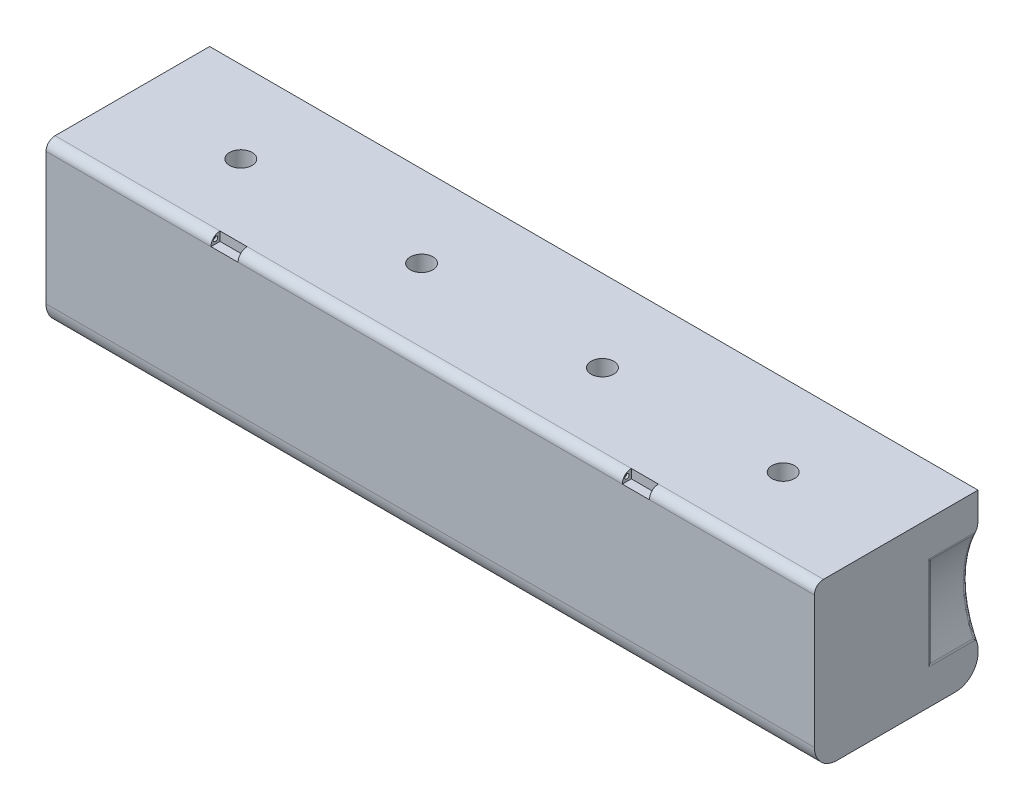
from build123d import *

# Parameters (mm, degrees)
SKETCH1_W           = 85
SKETCH1_H           = 18.1
BOSS_EXTRUDE1_DEPTH = 18.1
SKETCH2_W           = 80
SKETCH2_H           = 13.1
CUT_EXTRUDE1_DEPTH  = 17.5
SKETCH3_R           = 1.25
CUT_EXTRUDE2_DEPTH  = 2.5
SKETCH4_W           = 3
SKETCH4_H           = 1
CUT_EXTRUDE4_DEPTH  = 1
BOSS_EXTRUDE3_DEPTH = 1
SKETCH5_R           = 0.25
CUT_EXTRUDE5_DEPTH  = 0.25
CUT_EXTRUDE6_START  = -0.25
SKETCH6_R           = 0.25
CUT_EXTRUDE6_DEPTH  = 0.25
CUT_EXTRUDE7_START  = -0.25
SKETCH7_R           = 0.25
CUT_EXTRUDE7_DEPTH  = 0.25
SKETCH8_R           = 0.25
CUT_EXTRUDE8_DEPTH  = 0.25
CUT_EXTRUDE9_REACH  = 89.376
SKETCH13_R          = 1.390804474
SKETCH13_R_2        = 0.659370612
SKETCH13_R_3        = 0.42561601
CUT_EXTRUDE10_DEPTH = 0.5
CUT_EXTRUDE11_DEPTH = 5
FILLET1_R           = 0.5
CUT_EXTRUDE12_START = -85
CUT_EXTRUDE12_DEPTH = 85


with BuildPart() as part:
    # Sketch1 → Boss-Extrude1 (new body)
    with BuildSketch(Plane.XY):
        Rectangle(SKETCH1_W, SKETCH1_H)
    extrude(amount=BOSS_EXTRUDE1_DEPTH)

    # Sketch2 → Cut-Extrude1 (cut)
    with BuildSketch(Plane(origin=(0, 0, 0), x_dir=(-1, 0, 0), z_dir=(0, 0, -1))):
        Rectangle(SKETCH2_W, SKETCH2_H)
    extrude(amount=-CUT_EXTRUDE1_DEPTH, mode=Mode.SUBTRACT)

    # Sketch3 → Cut-Extrude2 (cut)
    with BuildSketch(Plane(origin=(0, 9.05, 0), x_dir=(1, 0, 0), z_dir=(0, 1, 0))):
        with Locations(Location((-30, -9.05, 0), (0, 0, 180))):
            Circle(SKETCH3_R)
        with Locations(Location((-10, -9.05, 0), (0, 0, 180))):
            Circle(SKETCH3_R)
        with Locations(Location((10, -9.05, 0), (0, 0, 180))):
            Circle(SKETCH3_R)
        with Locations(Location((30, -9.05, 0), (0, 0, 180))):
            Circle(SKETCH3_R)
    extrude(amount=-CUT_EXTRUDE2_DEPTH, mode=Mode.SUBTRACT)

    # Sketch4 → Cut-Extrude4 (cut)
    with BuildSketch(Plane.XY.offset(18.1)):
        with Locations((-22.75, 8.55)):
            Rectangle(SKETCH4_W, SKETCH4_H)
        with Locations((22.75, 8.55)):
            Rectangle(SKETCH4_W, SKETCH4_H)
    extrude(amount=-CUT_EXTRUDE4_DEPTH, mode=Mode.SUBTRACT)

    # Sketch11 → Boss-Extrude3 (add)
    with BuildSketch(Plane.XY.offset(18.1)):
        Polygon((-24.25, 8.05), (-24.25, 9.05), (-42.5, 9.05), (-42.5, -9.05), (42.5, -9.05), (42.5, 9.05), (24.25, 9.05), (24.25, 8.05), (21.25, 8.05), (21.25, 9.05), (-21.25, 9.05), (-21.25, 8.05), align=None)
    extrude(amount=-BOSS_EXTRUDE3_DEPTH)

    # Sketch5 → Cut-Extrude5 (cut)
    with BuildSketch(Plane(origin=(-24.25, 0, 0), x_dir=(0, 0, -1), z_dir=(1, 0, 0))):
        with Locations((-17.6, 8.55)):
            Circle(SKETCH5_R)
    extrude(amount=-CUT_EXTRUDE5_DEPTH, mode=Mode.SUBTRACT)

    # Sketch6 → Cut-Extrude6 (cut)
    with BuildSketch(Plane.ZY.offset(21.25).offset(CUT_EXTRUDE6_START)):
        with Locations(Location((17.6, 8.55, 0), (0, 0, 180))):
            Circle(SKETCH6_R)
    extrude(amount=CUT_EXTRUDE6_DEPTH, mode=Mode.SUBTRACT)

    # Sketch7 → Cut-Extrude7 (cut)
    with BuildSketch(Plane.ZY.offset(-24.25).offset(CUT_EXTRUDE7_START)):
        with Locations(Location((17.6, 8.55, 0), (0, 0, 180))):
            Circle(SKETCH7_R)
    extrude(amount=CUT_EXTRUDE7_DEPTH, mode=Mode.SUBTRACT)

    # Sketch8 → Cut-Extrude8 (cut)
    with BuildSketch(Plane(origin=(21.25, 0, 0), x_dir=(0, 0, -1), z_dir=(1, 0, 0))):
        with Locations((-17.6, 8.55)):
            Circle(SKETCH8_R)
    extrude(amount=-CUT_EXTRUDE8_DEPTH, mode=Mode.SUBTRACT)

    # Cut-Extrude9: up to this face of the body (flat: up to its plane)
    cut_extrude9_end = Plane(part.part.faces().sort_by_distance((-42.5, 0, 9.05))[0])
    # Sketch12 → Cut-Extrude9 (cut, up to the picked face)
    with BuildSketch(Plane(origin=(42.5, 0, 0), x_dir=(0, 0, -1), z_dir=(1, 0, 0)), mode=Mode.PRIVATE) as cut_extrude9_sk1:
        with BuildLine():
            Line((-18.1, -6.55), (-18.1, -9.05))
            Line((-18.1, -9.05), (-15.6, -9.05))
            ThreePointArc((-15.6, -9.05), (-17.367766953, -8.317766953), (-18.1, -6.55))
        make_face()
    cut_extrude9_tool1 = split(extrude(cut_extrude9_sk1.sketch, amount=-CUT_EXTRUDE9_REACH, mode=Mode.PRIVATE), bisect_by=cut_extrude9_end, keep=Keep.BOTH, mode=Mode.PRIVATE)
    # Sketch12 → Cut-Extrude9 (cut, up to the picked face)
    with BuildSketch(Plane(origin=(42.5, 0, 0), x_dir=(0, 0, -1), z_dir=(1, 0, 0)), mode=Mode.PRIVATE) as cut_extrude9_sk2:
        with BuildLine():
            Line((-2.5, -9.05), (0, -9.05))
            Line((0, -9.05), (0, -6.55))
            ThreePointArc((0, -6.55), (-0.732233047, -8.317766953), (-2.5, -9.05))
        make_face()
    cut_extrude9_tool2 = split(extrude(cut_extrude9_sk2.sketch, amount=-CUT_EXTRUDE9_REACH, mode=Mode.PRIVATE), bisect_by=cut_extrude9_end, keep=Keep.BOTH, mode=Mode.PRIVATE)
    add(cut_extrude9_tool1.solids().sort_by(Axis((42.5, -8.49158, 17.54158), (-1, 0, 0)))[0], mode=Mode.SUBTRACT)
    add(cut_extrude9_tool2.solids().sort_by(Axis((42.5, -8.49158, 0.55842), (-1, 0, 0)))[0], mode=Mode.SUBTRACT)

    # Sketch13 → Cut-Extrude10 (cut)
    # profile 1 of 4: a face of its own
    with BuildSketch(Plane.XZ.offset(9.05)):
        with Locations((-34.135654856, 9.05)):
            Circle(SKETCH13_R)
        with BuildLine():
            Line((-34.009203979, 10.17572082), (-34.009203979, 8.391358435))
            ThreePointArc((-34.009203979, 8.391358435), (-34.135654856, 8.264907558), (-34.262105734, 8.391358435))
            Line((-34.262105734, 8.391358435), (-34.262105734, 10.17572082))
            ThreePointArc((-34.262105734, 10.17572082), (-34.135654856, 10.302171697), (-34.009203979, 10.17572082))
        make_face(mode=Mode.SUBTRACT)
        with BuildLine():
            ThreePointArc((-34.868750994, 10.048689821), (-34.135654856, 7.811124984), (-33.402558718, 10.048689821))
            ThreePointArc((-33.402558718, 10.048689821), (-33.657371419, 10.009610716), (-33.618292315, 9.754798016))
            ThreePointArc((-33.618292315, 9.754798016), (-34.135654856, 8.175697855), (-34.653017397, 9.754798016))
            ThreePointArc((-34.653017397, 9.754798016), (-34.613938293, 10.009610716), (-34.868750994, 10.048689821))
        make_face(mode=Mode.SUBTRACT)
    # profile 2 of 4: a face of its own
    with BuildSketch(Plane.XZ.offset(9.05)):
        with Locations((-29.135654856, 9.05)):
            Circle(SKETCH13_R_2)
        with Locations((-29.135654856, 9.05)):
            Circle(SKETCH13_R_3, mode=Mode.SUBTRACT)
    # profile 3 of 4: a face of its own
    with BuildSketch(Plane.XZ.offset(9.05)):
        with Locations((-26.635654856, 9.05)):
            Circle(SKETCH13_R_2)
        with Locations((-26.635654856, 9.05)):
            Circle(SKETCH13_R_3, mode=Mode.SUBTRACT)
    # profile 4 of 4: a face of its own
    with BuildSketch(Plane.XZ.offset(9.05)):
        with Locations((-24.135654856, 9.05)):
            Circle(SKETCH13_R_2)
        with Locations((-24.135654856, 9.05)):
            Circle(SKETCH13_R_3, mode=Mode.SUBTRACT)
    extrude(amount=-CUT_EXTRUDE10_DEPTH, mode=Mode.SUBTRACT)

    # Sketch16 → Cut-Extrude11 (cut)
    with BuildSketch(Plane(origin=(0, 0, 0), x_dir=(-1, 0, 0), z_dir=(0, 0, -1))):
        with BuildLine():
            Line((-42.5, -5.059421515), (-42.5, 5.059421515))
            ThreePointArc((-42.5, 5.059421515), (-41.365768493, 0), (-42.5, -5.059421515))
        make_face()
        with BuildLine():
            Line((42.5, -5.059421515), (42.5, 5.059421515))
            ThreePointArc((42.5, 5.059421515), (41.365768493, 0), (42.5, -5.059421515))
        make_face()
    extrude(amount=-CUT_EXTRUDE11_DEPTH, mode=Mode.SUBTRACT)

    # Fillet1
    fillet1_edges = [part.edges().sort_by_distance(p)[0] for p in [
        (-42.5, -5.059421515, 2.5),
        (-42.5, 0, 5),
        (-42.5, 5.059421515, 2.5),
        (-41.365768493, 0, 0),
        (42.5, 5.059421515, 2.5),
        (42.5, 0, 5),
        (42.5, -5.059421515, 2.5),
        (41.365768493, 0, 0),
    ]]
    fillet(fillet1_edges, radius=FILLET1_R)

    # Sketch17 → Cut-Extrude12 (cut)
    with BuildSketch(Plane(origin=(42.5, 0, 0), x_dir=(0, 0, -1), z_dir=(1, 0, 0)).offset(CUT_EXTRUDE12_START)):
        with BuildLine():
            Line((-18.1, 8.05), (-18.1, 9.05))
            Line((-18.1, 9.05), (-17.1, 9.05))
            ThreePointArc((-17.1, 9.05), (-17.807106781, 8.757106781), (-18.1, 8.05))
        make_face()
    extrude(amount=CUT_EXTRUDE12_DEPTH, mode=Mode.SUBTRACT)


solid = part.part
